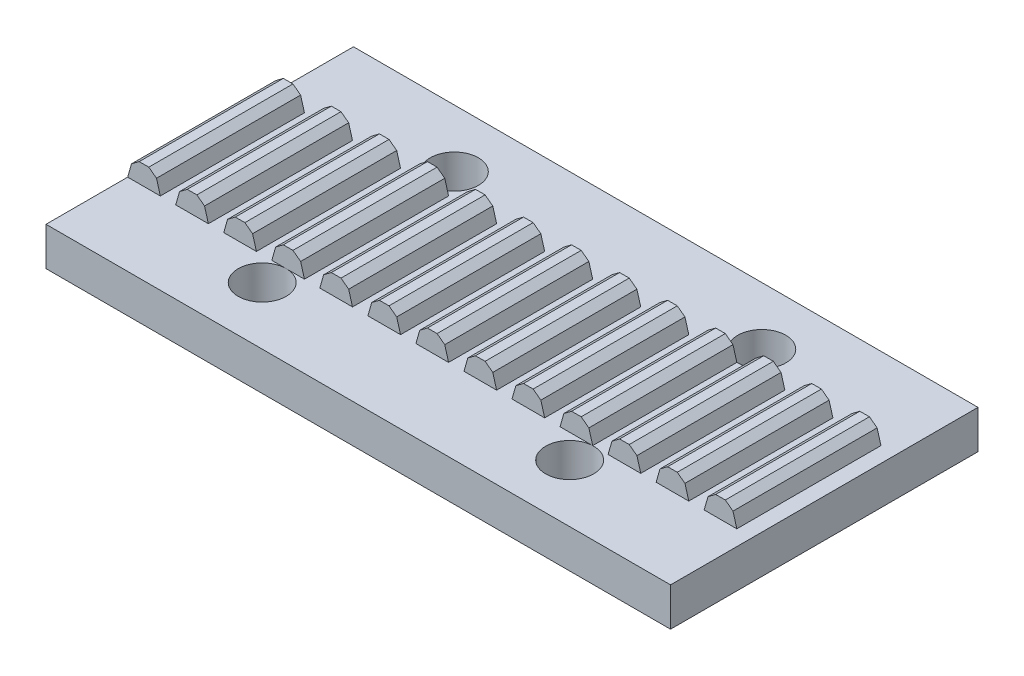
from build123d import *

# Parameters (mm, degrees)
SKETCH1_W           = 65
SKETCH1_H           = 32
SKETCH1_R           = 2.5
BOSS_EXTRUDE1_DEPTH = 4
SKETCH2_W           = 65
SKETCH2_H           = 15
BOSS_EXTRUDE2_DEPTH = 2
CUT_EXTRUDE2_DEPTH  = 41.552435192


with BuildPart() as part:
    # Sketch1 → Boss-Extrude1 (new body)
    with BuildSketch(Plane(origin=(0, 0, 0), x_dir=(1, 0, 0), z_dir=(0, 1, 0))):
        Rectangle(SKETCH1_W, SKETCH1_H)
        with Locations((-16, 10)):
            Circle(SKETCH1_R, mode=Mode.SUBTRACT)
        with Locations((16, 10)):
            Circle(SKETCH1_R, mode=Mode.SUBTRACT)
        with Locations((-16, -10)):
            Circle(SKETCH1_R, mode=Mode.SUBTRACT)
        with Locations((16, -10)):
            Circle(SKETCH1_R, mode=Mode.SUBTRACT)
    extrude(amount=BOSS_EXTRUDE1_DEPTH)

    # Sketch2 → Boss-Extrude2 (add)
    with BuildSketch(Plane(origin=(0, 4, 0), x_dir=(1, 0, 0), z_dir=(0, 1, 0))):
        Rectangle(SKETCH2_W, SKETCH2_H)
    extrude(amount=BOSS_EXTRUDE2_DEPTH)

    # Sketch3 → Cut-Extrude2 (cut, through all)
    with BuildSketch(Plane.XY.offset(7.5)):
        Polygon((-32.5, 6), (-32.5, 4), (-32.1, 5.4), (-31.3, 6), align=None)
        Polygon((-29.5, 5.4), (-29.1, 4), (-27.5, 4), (-27.1, 5.4), (-26.3, 6), (-30.3, 6), align=None)
        Polygon((-24.5, 5.4), (-24.1, 4), (-22.5, 4), (-22.1, 5.4), (-21.3, 6), (-24.1, 6), (-25.3, 6), align=None)
        Polygon((-19.5, 5.4), (-19.1, 4), (-17.5, 4), (-17.1, 5.4), (-16.3, 6), (-20.3, 6), align=None)
        Polygon((-14.5, 5.4), (-14.1, 4), (-12.5, 4), (-12.1, 5.4), (-11.3, 6), (-15.3, 6), align=None)
        Polygon((-9.5, 5.4), (-9.1, 4), (-7.5, 4), (-7.1, 5.4), (-6.3, 6), (-10.3, 6), align=None)
        Polygon((-4.5, 5.4), (-4.1, 4), (-2.5, 4), (-2.1, 5.4), (-1.3, 6), (-5.3, 6), align=None)
        Polygon((0.5, 5.4), (0.9, 4), (2.5, 4), (2.9, 5.4), (3.7, 6), (-0.3, 6), align=None)
        Polygon((5.5, 5.4), (5.9, 4), (7.5, 4), (7.9, 5.4), (8.7, 6), (4.7, 6), align=None)
        Polygon((10.5, 5.4), (10.9, 4), (12.5, 4), (12.9, 5.4), (13.7, 6), (9.7, 6), align=None)
        Polygon((15.5, 5.4), (15.9, 4), (17.5, 4), (17.9, 5.4), (18.7, 6), (14.7, 6), align=None)
        Polygon((20.5, 5.4), (20.9, 4), (22.5, 4), (22.9, 5.4), (23.7, 6), (19.7, 6), align=None)
        Polygon((25.5, 5.4), (25.9, 4), (27.5, 4), (27.9, 5.4), (28.7, 6), (24.7, 6), align=None)
        Polygon((30.5, 5.4), (30.9, 4), (32.5, 4), (32.5, 6), (29.7, 6), align=None)
    extrude(amount=-CUT_EXTRUDE2_DEPTH, mode=Mode.SUBTRACT)


solid = part.part
